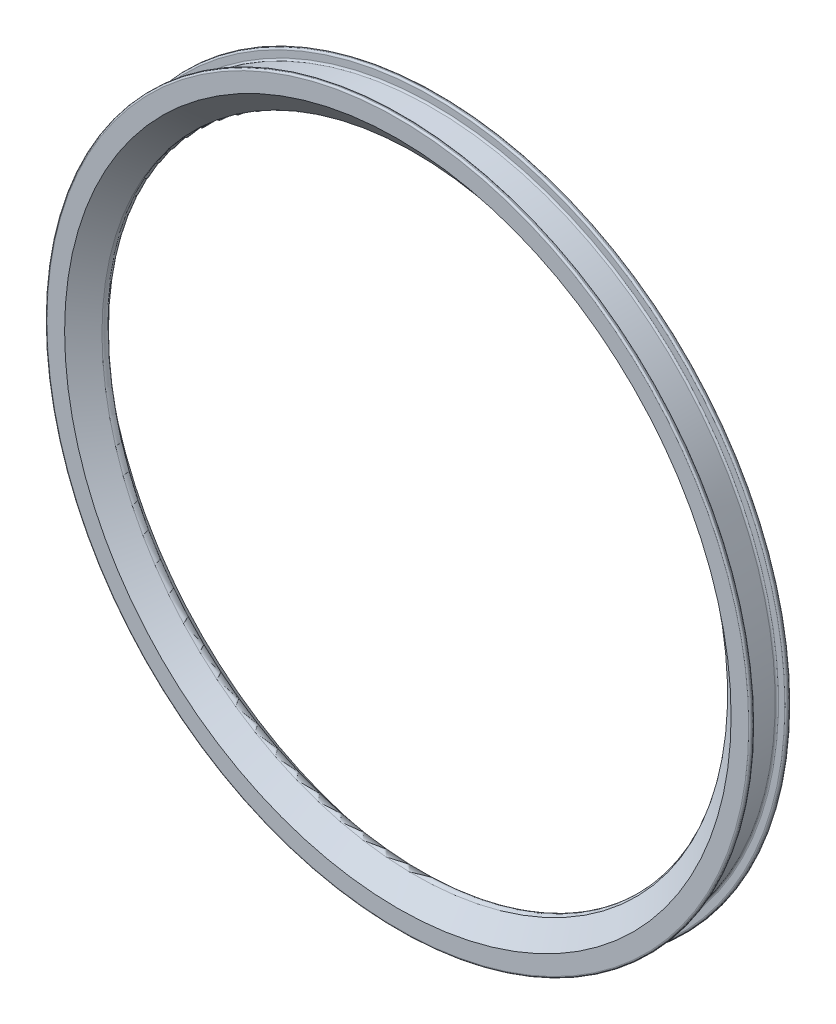
from build123d import *

# Parameters (mm, degrees)
FILLET1_R = 2.5
FILLET2_R = 1


with BuildPart() as part:
    # Sketch2 → Revolve1 (revolve)
    with BuildSketch(Plane(origin=(0, 0, 0), x_dir=(1, 0, 0), z_dir=(0, 1, 0)), mode=Mode.PRIVATE) as revolve1_sk:
        Polygon((184, 0), (198.5, 12), (210, 12), (210, 9.5), (204.25, 9.5), (204.25, -9.5), (210, -9.5), (210, -12), (198.5, -12), align=None)
    revolve(revolve1_sk.sketch.rotate(Axis((0, 0, -28.442447853), (0, 0, 1)), 180), axis=Axis((0, 0, -28.442447853), (0, 0, 1)))

    # Fillet1
    fillet1_edges = [part.edges().sort_by_distance(p)[0] for p in [
        (184, 0, 0),
    ]]
    fillet(fillet1_edges, radius=FILLET1_R)

    # Fillet2
    fillet2_edges = [part.edges().sort_by_distance(p)[0] for p in [
        (210, 0, -12),
        (210, 0, 12),
        (210, 0, 9.5),
        (204.25, 0, 9.5),
        (204.25, 0, -9.5),
        (210, 0, -9.5),
    ]]
    fillet(fillet2_edges, radius=FILLET2_R)


solid = part.part
